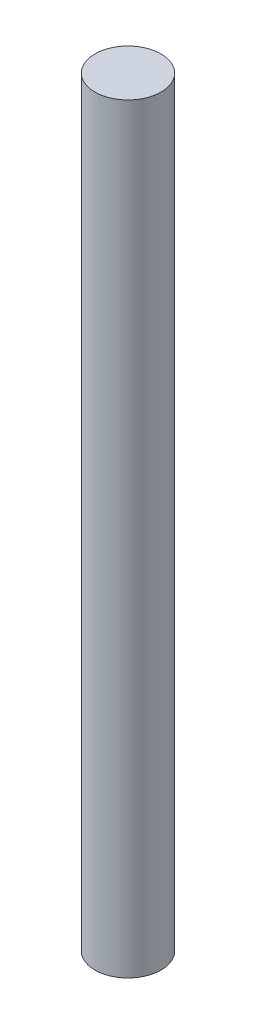
from build123d import *

# Parameters (mm, degrees)
SKETCH1_R           = 6.35
BOSS_EXTRUDE1_DEPTH = 73.025


with BuildPart() as part:
    # Sketch1 → Boss-Extrude1 (new, symmetric)
    with BuildSketch(Plane(origin=(0, 0, 0), x_dir=(1, 0, 0), z_dir=(0, 1, 0))):
        with Locations(Location((0, 0, 0), (0, 0, 270))):
            Circle(SKETCH1_R)
    extrude(amount=BOSS_EXTRUDE1_DEPTH, both=True)


solid = part.part
